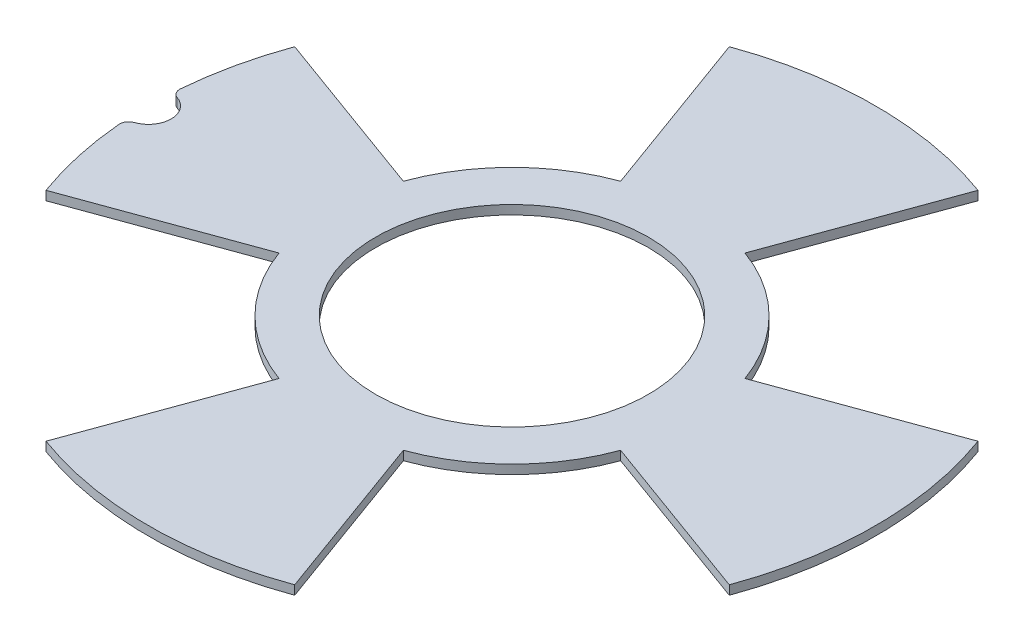
from build123d import *

# Parameters (mm, degrees)
SKETCH1_R           = 15
BOSS_EXTRUDE1_DEPTH = 1


with BuildPart() as part:
    # Sketch1 → Boss-Extrude1 (new body)
    with BuildSketch(Plane(origin=(0, 0, 0), x_dir=(1, 0, 0), z_dir=(0, 1, 0))):
        with BuildLine():
            Line((37.587704831, -13.680805733), (18.793852416, -6.840402867))
            ThreePointArc((18.793852416, -6.840402867), (14.142135624, -14.142135624), (6.840402867, -18.793852416))
            Line((6.840402867, -18.793852416), (13.680805733, -37.587704831))
            ThreePointArc((13.680805733, -37.587704831), (0, -40), (-13.680805733, -37.587704831))
            Line((-13.680805733, -37.587704831), (-6.840402867, -18.793852416))
            ThreePointArc((-6.840402867, -18.793852416), (-14.142135624, -14.142135624), (-18.793852416, -6.840402867))
            Line((-18.793852416, -6.840402867), (-37.587704831, -13.680805733))
            ThreePointArc((-37.587704831, -13.680805733), (-39.061857441, -8.612275732), (-39.855769231, -3.393767674))
            ThreePointArc((-39.855769231, -3.393767674), (-39.69750686, -2.763455807), (-39.185267857, -2.363516773))
            ThreePointArc((-39.185267857, -2.363516773), (-37.5, 0), (-39.185267857, 2.363516773))
            ThreePointArc((-39.185267857, 2.363516773), (-39.69750686, 2.763455807), (-39.855769231, 3.393767674))
            ThreePointArc((-39.855769231, 3.393767674), (-39.061857441, 8.612275732), (-37.587704831, 13.680805733))
            Line((-37.587704831, 13.680805733), (-18.793852416, 6.840402867))
            ThreePointArc((-18.793852416, 6.840402867), (-14.142135624, 14.142135624), (-6.840402867, 18.793852416))
            Line((-6.840402867, 18.793852416), (-13.680805733, 37.587704831))
            ThreePointArc((-13.680805733, 37.587704831), (0, 40), (13.680805733, 37.587704831))
            Line((13.680805733, 37.587704831), (6.840402867, 18.793852416))
            ThreePointArc((6.840402867, 18.793852416), (14.142135624, 14.142135624), (18.793852416, 6.840402867))
            Line((18.793852416, 6.840402867), (37.587704831, 13.680805733))
            ThreePointArc((37.587704831, 13.680805733), (40, 0), (37.587704831, -13.680805733))
        make_face()
        with Locations(Location((0, 0, 0), (0, 0, 270))):
            Circle(SKETCH1_R, mode=Mode.SUBTRACT)
    extrude(amount=BOSS_EXTRUDE1_DEPTH)


solid = part.part
